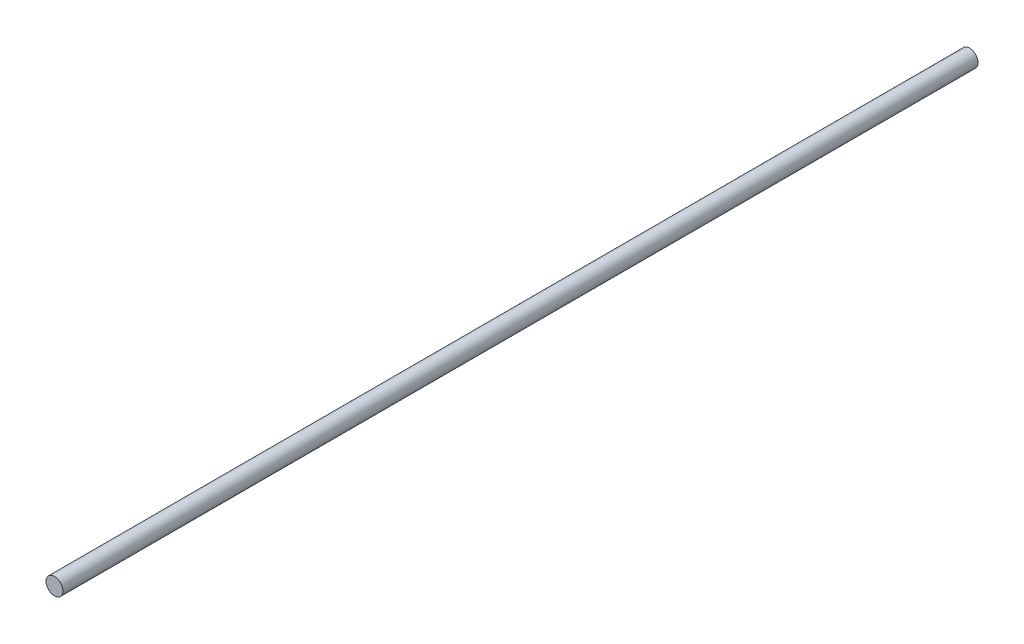
from build123d import *

# Parameters (mm, degrees)
SKETCH1_R           = 4
BOSS_EXTRUDE1_DEPTH = 433


with BuildPart() as part:
    # Sketch1 → Boss-Extrude1 (new body)
    with BuildSketch(Plane.XY):
        with Locations(Location((0, 0, 0), (0, 0, 180))):
            Circle(SKETCH1_R)
    extrude(amount=BOSS_EXTRUDE1_DEPTH)


solid = part.part
